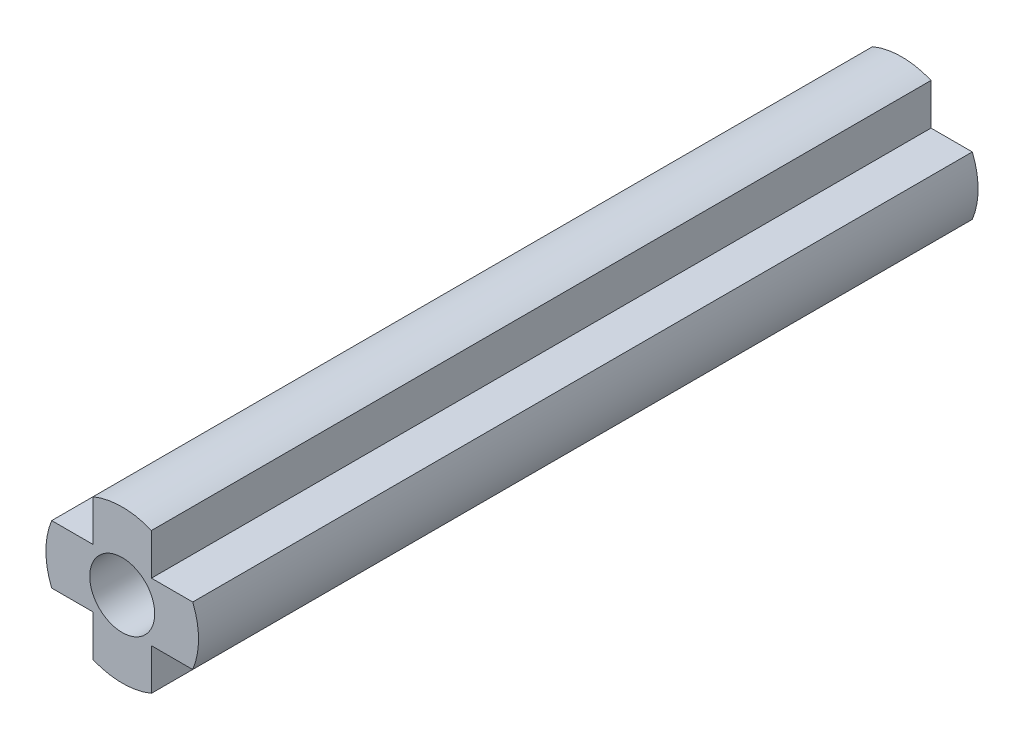
from build123d import *

# Parameters (mm, degrees)
BOSS_EXTRUDE1_DEPTH = 24
SKETCH2_R           = 1
CUT_EXTRUDE1_DEPTH  = 13


with BuildPart() as part:
    # Sketch1 → Boss-Extrude1 (new body)
    with BuildSketch(Plane.XY):
        with BuildLine():
            Line((-0.9, 2.170829335), (-0.9, 0.9))
            Line((-0.9, 0.9), (-2.170829335, 0.9))
            ThreePointArc((-2.170829335, 0.9), (-2.35, 0), (-2.170829335, -0.9))
            Line((-2.170829335, -0.9), (-0.9, -0.9))
            Line((-0.9, -0.9), (-0.9, -2.170829335))
            ThreePointArc((-0.9, -2.170829335), (0, -2.35), (0.9, -2.170829335))
            Line((0.9, -2.170829335), (0.9, -0.9))
            Line((0.9, -0.9), (2.170829335, -0.9))
            ThreePointArc((2.170829335, -0.9), (2.35, 0), (2.170829335, 0.9))
            Line((2.170829335, 0.9), (0.9, 0.9))
            Line((0.9, 0.9), (0.9, 2.170829335))
            ThreePointArc((0.9, 2.170829335), (0, 2.35), (-0.9, 2.170829335))
        make_face()
    extrude(amount=BOSS_EXTRUDE1_DEPTH)

    # Sketch2 → Cut-Extrude1 (cut)
    with BuildSketch(Plane.XY.offset(24)):
        Circle(SKETCH2_R)
    extrude(amount=-CUT_EXTRUDE1_DEPTH, mode=Mode.SUBTRACT)


solid = part.part
